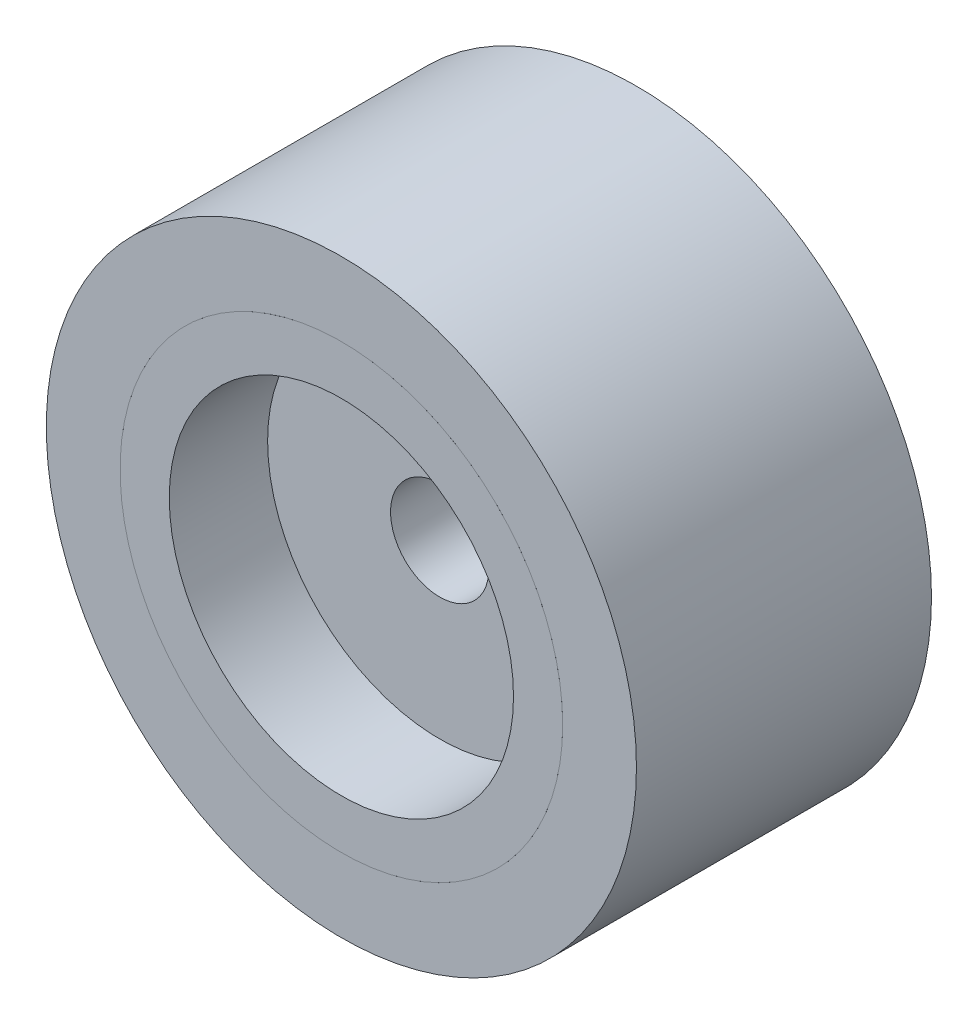
from build123d import *

# Parameters (mm, degrees)
SKETCH3_W = 35.998
SKETCH3_H = 8.999


with BuildPart() as part:
    # Sketch1 → Revolve1 (revolve)
    with BuildSketch(Plane(origin=(0, 0, 0), x_dir=(0, 0, -1), z_dir=(1, 0, 0)), mode=Mode.PRIVATE) as revolve1_sk:
        Polygon((0, 6), (0, 21), (-12, 21), (-12, 27), (24, 27), (24, 21), (12, 21), (12, 6), align=None)
    revolve(revolve1_sk.sketch.rotate(Axis((0, 0, 0), (0, 0, -1)), 90), axis=Axis((0, 0, 0), (0, 0, -1)))


with BuildPart() as body_2:
    # Sketch3 → Revolve2 (revolve)
    with BuildSketch(Plane(origin=(0, 0, 0), x_dir=(0, 0, -1), z_dir=(1, 0, 0)), mode=Mode.PRIVATE) as revolve2_sk:
        with Locations((6, 31.5005)):
            Rectangle(SKETCH3_W, SKETCH3_H)
    revolve(revolve2_sk.sketch.rotate(Axis((0, 0, 0), (0, 0, -1)), 90), axis=Axis((0, 0, 0), (0, 0, -1)))


solid = Compound([part.part, body_2.part])
